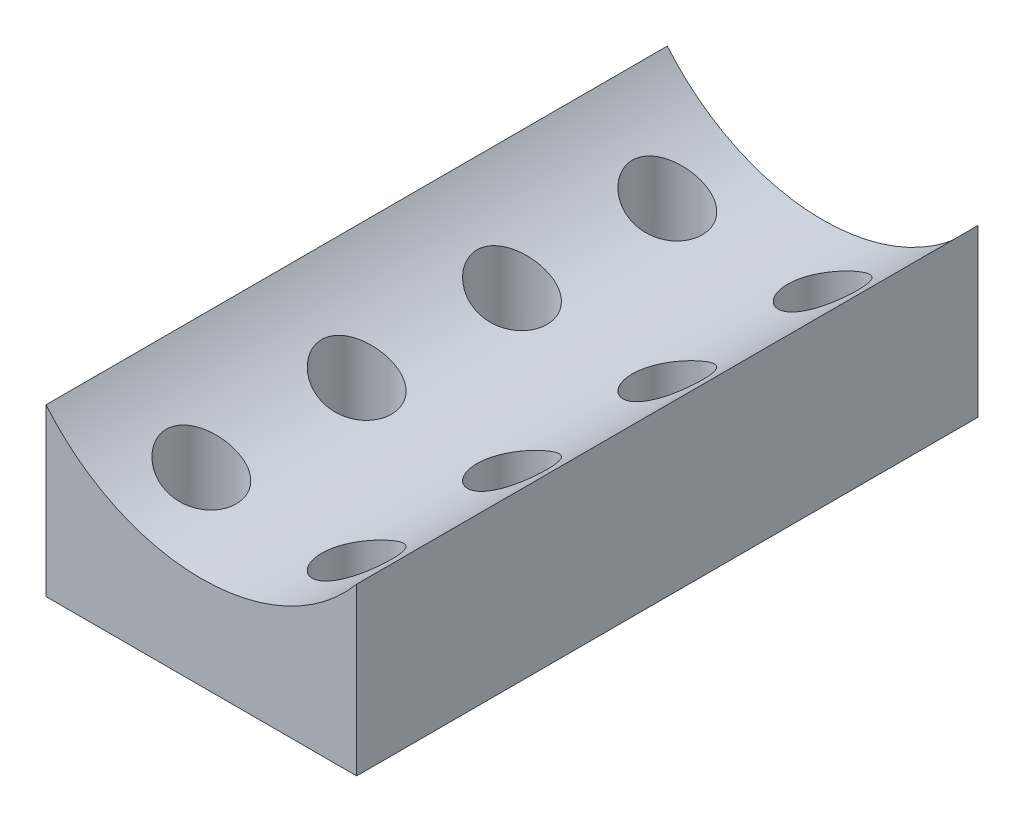
from build123d import *

# Parameters (mm, degrees)
BOSS_EXTRUDE1_DEPTH = 40
SKETCH2_R           = 2.25
CUT_EXTRUDE1_DEPTH  = 43.595167487
CHAMFER1_SIZE       = 1


with BuildPart() as part:
    # Sketch1 → Boss-Extrude1 (new body)
    with BuildSketch(Plane.XY):
        with BuildLine():
            Line((-10, -5.346688069), (10, -5.346688069))
            Line((10, -5.346688069), (10, 5.346688069))
            ThreePointArc((10, 5.346688069), (0, 0.653311931), (-10, 5.346688069))
            Line((-10, 5.346688069), (-10, -5.346688069))
        make_face()
    extrude(amount=BOSS_EXTRUDE1_DEPTH)

    # Sketch2 → Cut-Extrude1 (cut, through all)
    with BuildSketch(Plane.XZ.offset(5.346688069)):
        with Locations(Location((5, 5, 0), (0, 0, 270))):
            Circle(SKETCH2_R)
        with Locations(Location((-5, 5, 0), (0, 0, 270))):
            Circle(SKETCH2_R)
        with Locations(Location((-5, 15, 0), (0, 0, 270))):
            Circle(SKETCH2_R)
        with Locations(Location((5, 15, 0), (0, 0, 270))):
            Circle(SKETCH2_R)
        with Locations(Location((-5, 25, 0), (0, 0, 270))):
            Circle(SKETCH2_R)
        with Locations(Location((5, 25, 0), (0, 0, 270))):
            Circle(SKETCH2_R)
        with Locations(Location((-5, 35, 0), (0, 0, 270))):
            Circle(SKETCH2_R)
        with Locations(Location((5, 35, 0), (0, 0, 270))):
            Circle(SKETCH2_R)
    extrude(amount=-CUT_EXTRUDE1_DEPTH, mode=Mode.SUBTRACT)

    # Chamfer1
    chamfer1_edges = [part.edges().sort_by_distance(p)[0] for p in [
        (5, -5.346688069, 27.25),
        (-5, -5.346688069, 17.25),
        (5, -5.346688069, 17.25),
        (-5, -5.346688069, 7.25),
        (-5, -5.346688069, 37.25),
        (5, -5.346688069, 37.25),
        (-5, -5.346688069, 27.25),
        (5, -5.346688069, 7.25),
    ]]
    chamfer(chamfer1_edges, length=CHAMFER1_SIZE)


solid = part.part
